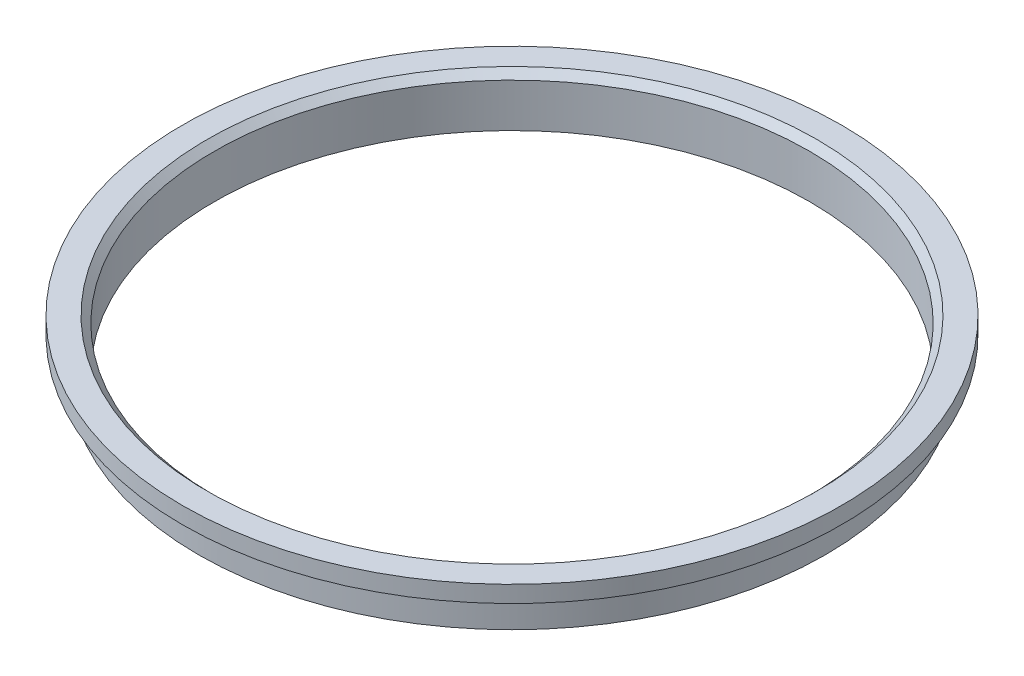
from build123d import *

# Parameters (mm, degrees)
CHAMFER1_SIZE = 1.27
FILLET1_R     = 1.5875


with BuildPart() as part:
    # Sketch1 → Revolve1 (revolve)
    with BuildSketch(Plane.XY, mode=Mode.PRIVATE) as revolve1_sk:
        Polygon((-54.55285, 0), (-54.55285, -9.271), (-57.43575, -9.271), (-57.43575, -3.048), (-60.3631, -3.048), (-60.3631, 0), align=None)
    revolve(revolve1_sk.sketch.rotate(Axis((0, 0, 0), (0, 1, 0)), 270), axis=Axis((0, 0, 0), (0, 1, 0)))

    # Chamfer1
    chamfer1_edges = [part.edges().sort_by_distance(p)[0] for p in [
        (0, 0, 54.55285),
    ]]
    chamfer(chamfer1_edges, length=CHAMFER1_SIZE)

    # Fillet1
    fillet1_edges = [part.edges().sort_by_distance(p)[0] for p in [
        (0, -3.048, 57.43575),
    ]]
    fillet(fillet1_edges, radius=FILLET1_R)


solid = part.part
